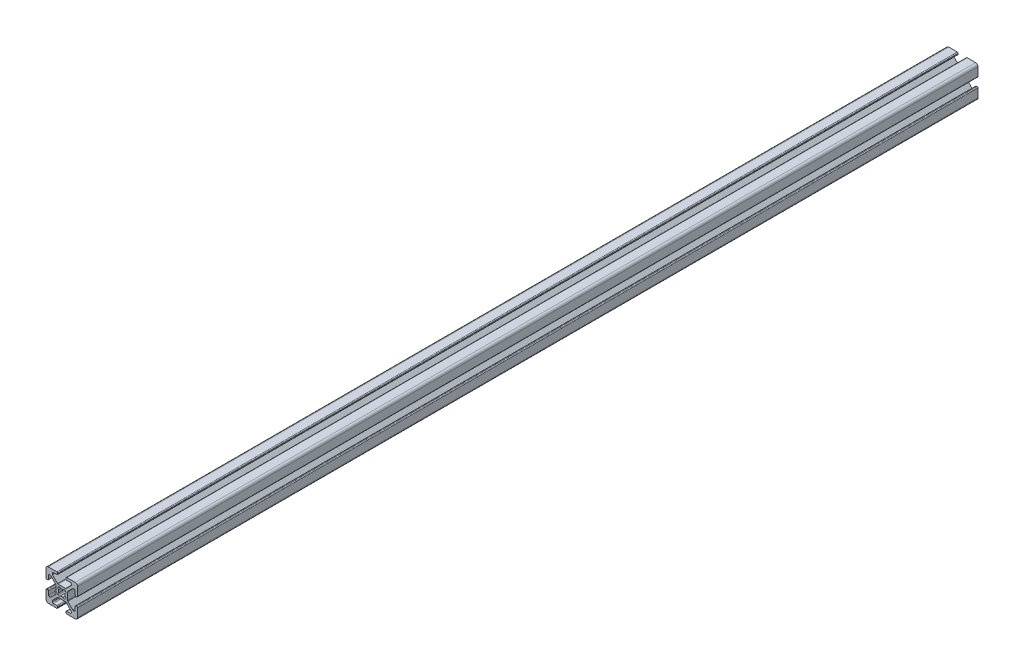
from build123d import *

# Parameters (mm, degrees)
EXTRUDE1_DEPTH = 570


with BuildPart() as part:
    # Sketch1 → Extrude1 (new body)
    with BuildSketch(Plane.XY):
        with BuildLine():
            Line((-5.032287798, -0.341059771), (-5.516287798, -0.341059771))
            ThreePointArc((-5.516287798, -0.341059771), (-5.875498042, -0.192270016), (-6.024287798, 0.166940229))
            Line((-6.024287798, 0.166940229), (-6.024287798, 2.515940229))
            ThreePointArc((-6.024287798, 2.515940229), (-6.173077553, 2.875150474), (-6.532287798, 3.023940229))
            Line((-6.532287798, 3.023940229), (-7.258207136, 3.023940229))
            ThreePointArc((-7.258207136, 3.023940229), (-7.45261032, 2.985271032), (-7.617417381, 2.875150474))
            Line((-7.617417381, 2.875150474), (-10.720498042, -0.227930187))
            ThreePointArc((-10.720498042, -0.227930187), (-10.8306186, -0.392737249), (-10.869287798, -0.587140432))
            Line((-10.869287798, -0.587140432), (-10.869287798, -5.354979109))
            ThreePointArc((-10.869287798, -5.354979109), (-10.8306186, -5.549382293), (-10.720498042, -5.714189354))
            Line((-10.720498042, -5.714189354), (-7.617417381, -8.817270016))
            ThreePointArc((-7.617417381, -8.817270016), (-7.45261032, -8.927390573), (-7.258207136, -8.966059771))
            Line((-7.258207136, -8.966059771), (-6.532287798, -8.966059771))
            ThreePointArc((-6.532287798, -8.966059771), (-6.173077553, -8.817270016), (-6.024287798, -8.458059771))
            Line((-6.024287798, -8.458059771), (-6.024287798, -6.109059771))
            ThreePointArc((-6.024287798, -6.109059771), (-5.875498042, -5.749849526), (-5.516287798, -5.601059771))
            Line((-5.516287798, -5.601059771), (-5.032287798, -5.601059771))
            ThreePointArc((-5.032287798, -5.601059771), (-4.673077553, -5.749849526), (-4.524287798, -6.109059771))
            Line((-4.524287798, -6.109059771), (-4.524287798, -11.471059771))
            ThreePointArc((-4.524287798, -11.471059771), (-4.963627626, -12.531719943), (-6.024287798, -12.971059771))
            Line((-6.024287798, -12.971059771), (-11.386287798, -12.971059771))
            ThreePointArc((-11.386287798, -12.971059771), (-11.745498042, -12.822270016), (-11.894287798, -12.463059771))
            Line((-11.894287798, -12.463059771), (-11.894287798, -11.979059771))
            ThreePointArc((-11.894287798, -11.979059771), (-11.745498042, -11.619849526), (-11.386287798, -11.471059771))
            Line((-11.386287798, -11.471059771), (-9.037287798, -11.471059771))
            ThreePointArc((-9.037287798, -11.471059771), (-8.678077553, -11.322270016), (-8.529287798, -10.963059771))
            Line((-8.529287798, -10.963059771), (-8.529287798, -10.237140432))
            ThreePointArc((-8.529287798, -10.237140432), (-8.567956995, -10.042737249), (-8.678077553, -9.877930187))
            Line((-8.678077553, -9.877930187), (-11.781158214, -6.774849526))
            ThreePointArc((-11.781158214, -6.774849526), (-11.945965275, -6.664728968), (-12.140368459, -6.626059771))
            Line((-12.140368459, -6.626059771), (-16.908207136, -6.626059771))
            ThreePointArc((-16.908207136, -6.626059771), (-17.10261032, -6.664728968), (-17.267417381, -6.774849526))
            Line((-17.267417381, -6.774849526), (-20.370498042, -9.877930187))
            ThreePointArc((-20.370498042, -9.877930187), (-20.4806186, -10.042737249), (-20.519287798, -10.237140432))
            Line((-20.519287798, -10.237140432), (-20.519287798, -10.963059771))
            ThreePointArc((-20.519287798, -10.963059771), (-20.370498042, -11.322270016), (-20.011287798, -11.471059771))
            Line((-20.011287798, -11.471059771), (-17.662287798, -11.471059771))
            ThreePointArc((-17.662287798, -11.471059771), (-17.303077553, -11.619849526), (-17.154287798, -11.979059771))
            Line((-17.154287798, -11.979059771), (-17.154287798, -12.463059771))
            ThreePointArc((-17.154287798, -12.463059771), (-17.303077553, -12.822270016), (-17.662287798, -12.971059771))
            Line((-17.662287798, -12.971059771), (-23.024287798, -12.971059771))
            ThreePointArc((-23.024287798, -12.971059771), (-24.084947969, -12.531719943), (-24.524287798, -11.471059771))
            Line((-24.524287798, -11.471059771), (-24.524287798, -6.109059771))
            ThreePointArc((-24.524287798, -6.109059771), (-24.375498042, -5.749849526), (-24.016287798, -5.601059771))
            Line((-24.016287798, -5.601059771), (-23.532287798, -5.601059771))
            ThreePointArc((-23.532287798, -5.601059771), (-23.173077553, -5.749849526), (-23.024287798, -6.109059771))
            Line((-23.024287798, -6.109059771), (-23.024287798, -8.458059771))
            ThreePointArc((-23.024287798, -8.458059771), (-22.875498042, -8.817270016), (-22.516287798, -8.966059771))
            Line((-22.516287798, -8.966059771), (-21.790368459, -8.966059771))
            ThreePointArc((-21.790368459, -8.966059771), (-21.595965275, -8.927390573), (-21.431158214, -8.817270016))
            Line((-21.431158214, -8.817270016), (-18.328077553, -5.714189354))
            ThreePointArc((-18.328077553, -5.714189354), (-18.217956995, -5.549382293), (-18.179287798, -5.354979109))
            Line((-18.179287798, -5.354979109), (-18.179287798, -0.587140432))
            ThreePointArc((-18.179287798, -0.587140432), (-18.217956995, -0.392737249), (-18.328077553, -0.227930187))
            Line((-18.328077553, -0.227930187), (-21.431158214, 2.875150474))
            ThreePointArc((-21.431158214, 2.875150474), (-21.595965275, 2.985271032), (-21.790368459, 3.023940229))
            Line((-21.790368459, 3.023940229), (-22.516287798, 3.023940229))
            ThreePointArc((-22.516287798, 3.023940229), (-22.875498042, 2.875150474), (-23.024287798, 2.515940229))
            Line((-23.024287798, 2.515940229), (-23.024287798, 0.166940229))
            ThreePointArc((-23.024287798, 0.166940229), (-23.173077553, -0.192270016), (-23.532287798, -0.341059771))
            Line((-23.532287798, -0.341059771), (-24.016287798, -0.341059771))
            ThreePointArc((-24.016287798, -0.341059771), (-24.375498042, -0.192270016), (-24.524287798, 0.166940229))
            Line((-24.524287798, 0.166940229), (-24.524287798, 5.528940229))
            ThreePointArc((-24.524287798, 5.528940229), (-24.084947969, 6.589600401), (-23.024287798, 7.028940229))
            Line((-23.024287798, 7.028940229), (-17.662287798, 7.028940229))
            ThreePointArc((-17.662287798, 7.028940229), (-17.303077553, 6.880150474), (-17.154287798, 6.520940229))
            Line((-17.154287798, 6.520940229), (-17.154287798, 6.036940229))
            ThreePointArc((-17.154287798, 6.036940229), (-17.303077553, 5.677729984), (-17.662287798, 5.528940229))
            Line((-17.662287798, 5.528940229), (-20.011287798, 5.528940229))
            ThreePointArc((-20.011287798, 5.528940229), (-20.370498042, 5.380150474), (-20.519287798, 5.020940229))
            Line((-20.519287798, 5.020940229), (-20.519287798, 4.295020891))
            ThreePointArc((-20.519287798, 4.295020891), (-20.4806186, 4.100617707), (-20.370498042, 3.935810646))
            Line((-20.370498042, 3.935810646), (-17.267417381, 0.832729984))
            ThreePointArc((-17.267417381, 0.832729984), (-17.10261032, 0.722609427), (-16.908207136, 0.683940229))
            Line((-16.908207136, 0.683940229), (-12.140368459, 0.683940229))
            ThreePointArc((-12.140368459, 0.683940229), (-11.945965275, 0.722609427), (-11.781158214, 0.832729984))
            Line((-11.781158214, 0.832729984), (-8.678077553, 3.935810646))
            ThreePointArc((-8.678077553, 3.935810646), (-8.567956995, 4.100617707), (-8.529287798, 4.295020891))
            Line((-8.529287798, 4.295020891), (-8.529287798, 5.020940229))
            ThreePointArc((-8.529287798, 5.020940229), (-8.678077553, 5.380150474), (-9.037287798, 5.528940229))
            Line((-9.037287798, 5.528940229), (-11.386287798, 5.528940229))
            ThreePointArc((-11.386287798, 5.528940229), (-11.745498042, 5.677729984), (-11.894287798, 6.036940229))
            Line((-11.894287798, 6.036940229), (-11.894287798, 6.520940229))
            ThreePointArc((-11.894287798, 6.520940229), (-11.745498042, 6.880150474), (-11.386287798, 7.028940229))
            Line((-11.386287798, 7.028940229), (-6.024287798, 7.028940229))
            ThreePointArc((-6.024287798, 7.028940229), (-4.963627626, 6.589600401), (-4.524287798, 5.528940229))
            Line((-4.524287798, 5.528940229), (-4.524287798, 0.166940229))
            ThreePointArc((-4.524287798, 0.166940229), (-4.673077553, -0.192270016), (-5.032287798, -0.341059771))
        make_face()
        with BuildLine():
            Line((-12.399386954, -5.275565737), (-12.219781831, -5.095960615))
            ThreePointArc((-12.219781831, -5.095960615), (-12.018349781, -4.327527582), (-12.589154291, -3.775036489))
            ThreePointArc((-12.589154291, -3.775036489), (-12.428787798, -2.971059771), (-12.589154291, -2.167083053))
            ThreePointArc((-12.589154291, -2.167083053), (-12.018349781, -1.61459196), (-12.219781831, -0.846158927))
            Line((-12.219781831, -0.846158927), (-12.399386954, -0.666553805))
            ThreePointArc((-12.399386954, -0.666553805), (-13.167819987, -0.465121754), (-13.72031108, -1.035926265))
            ThreePointArc((-13.72031108, -1.035926265), (-14.524287798, -0.875559771), (-15.328264516, -1.035926265))
            ThreePointArc((-15.328264516, -1.035926265), (-15.880755608, -0.465121754), (-16.649188641, -0.666553805))
            Line((-16.649188641, -0.666553805), (-16.828793764, -0.846158927))
            ThreePointArc((-16.828793764, -0.846158927), (-17.030225814, -1.61459196), (-16.459421304, -2.167083053))
            ThreePointArc((-16.459421304, -2.167083053), (-16.619787798, -2.971059771), (-16.459421304, -3.775036489))
            ThreePointArc((-16.459421304, -3.775036489), (-17.030225814, -4.327527582), (-16.828793764, -5.095960615))
            Line((-16.828793764, -5.095960615), (-16.649188641, -5.275565737))
            ThreePointArc((-16.649188641, -5.275565737), (-15.880755608, -5.476997788), (-15.328264516, -4.906193277))
            ThreePointArc((-15.328264516, -4.906193277), (-14.524287798, -5.066559771), (-13.72031108, -4.906193277))
            ThreePointArc((-13.72031108, -4.906193277), (-13.167819987, -5.476997788), (-12.399386954, -5.275565737))
        make_face(mode=Mode.SUBTRACT)
    extrude(amount=EXTRUDE1_DEPTH)


solid = part.part
